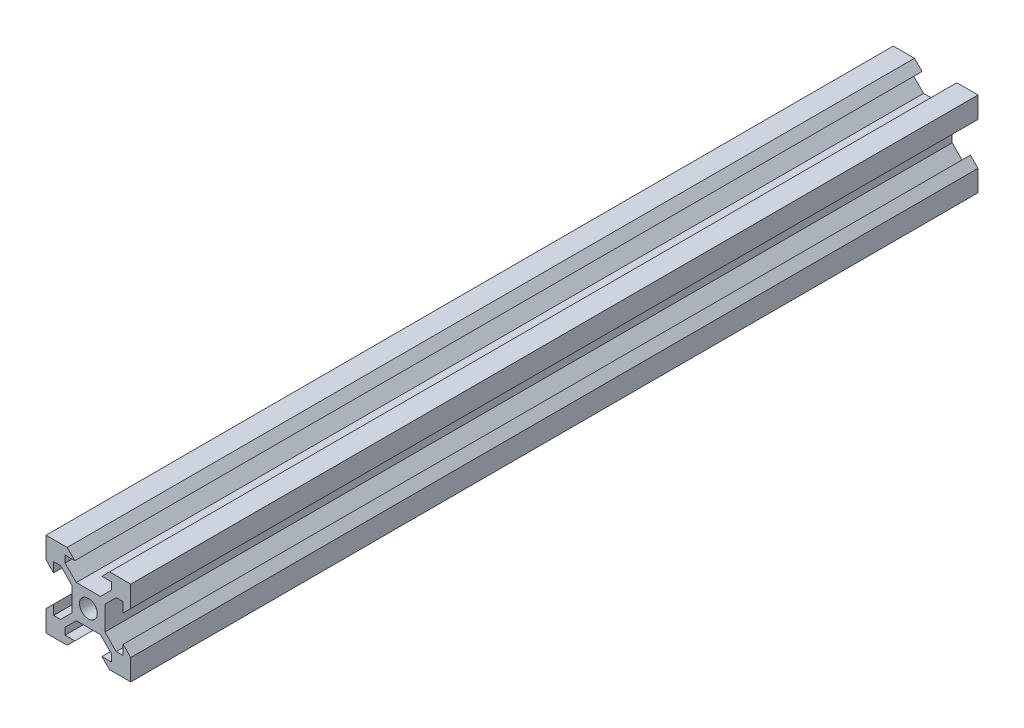
from build123d import *

# Parameters (mm, degrees)
SKETCH1_R           = 2.1
BOSS_EXTRUDE1_DEPTH = 200


with BuildPart() as part:
    # Sketch1 → Boss-Extrude1 (new body)
    with BuildSketch(Plane.XY):
        Polygon((-10, 10), (-10, 5), (-8.2, 3.2), (-8.2, 5.499339828), (-6.56, 5.499339828), (-3.900660172, 2.84), (-3.900660172, -2.84), (-6.56, -5.499339828), (-8.2, -5.499339828), (-8.2, -3.2), (-10, -5), (-10, -10), (-5, -10), (-3.2, -8.2), (-5.499339828, -8.2), (-5.499339828, -6.56), (-2.84, -3.900660172), (2.84, -3.900660172), (5.499339828, -6.56), (5.499339828, -8.2), (3.2, -8.2), (5, -10), (10, -10), (10, -5), (8.2, -3.2), (8.2, -5.499339828), (6.56, -5.499339828), (3.900660172, -2.84), (3.900660172, 2.84), (6.56, 5.499339828), (8.2, 5.499339828), (8.2, 3.2), (10, 5), (10, 10), (5, 10), (3.2, 8.2), (5.499339828, 8.2), (5.499339828, 6.56), (2.84, 3.900660172), (-2.84, 3.900660172), (-5.499339828, 6.56), (-5.499339828, 8.2), (-3.2, 8.2), (-5, 10), align=None)
        Circle(SKETCH1_R, mode=Mode.SUBTRACT)
    extrude(amount=-BOSS_EXTRUDE1_DEPTH)


solid = part.part
